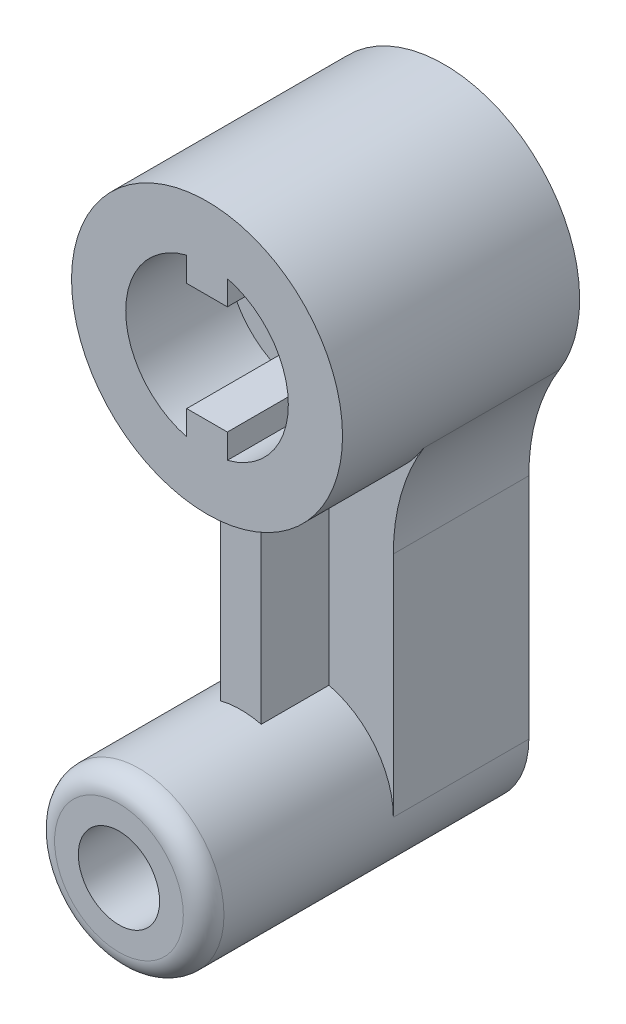
from build123d import *

# Parameters (mm, degrees)
SALIENTE_EXTRUIR1_DEPTH = 20
CROQUIS2_R              = 20
SALIENTE_EXTRUIR2_DEPTH = 35
CORTAR_EXTRUIR1_DEPTH   = 15
CORTAR_EXTRUIR2_REACH   = 68.332
CROQUIS4_R              = 4
CROQUIS5_R              = 12.5
CROQUIS5_R_2            = 6
SALIENTE_EXTRUIR3_DEPTH = 48
REDONDEO1_R             = 3
NERVIO1_REACH           = 91.22
CROQUIS6_WALL_W         = 207.940466532
CROQUIS6_WALL_H         = 6


with BuildPart() as part:
    # Croquis1 → Saliente-Extruir1 (new body)
    with BuildSketch(Plane.XY):
        with BuildLine():
            Line((-12.5, -26.339134382), (-12.5, -60))
            ThreePointArc((-12.5, -60), (0, -47.5), (12.5, -60))
            Line((12.5, -60), (12.5, -26.339134382))
            ThreePointArc((12.5, -26.339134382), (13.646923907, -18.12329602), (17, -10.535653753))
            ThreePointArc((17, -10.535653753), (0, -20), (-17, -10.535653753))
            ThreePointArc((-17, -10.535653753), (-13.646923907, -18.12329602), (-12.5, -26.339134382))
        make_face()
    extrude(amount=SALIENTE_EXTRUIR1_DEPTH)

    # Croquis2 → Saliente-Extruir2 (add)
    with BuildSketch(Plane.XY):
        with Locations(Location((0, 0, 0), (0, 0, 211.788330617))):
            Circle(CROQUIS2_R)
    extrude(amount=SALIENTE_EXTRUIR2_DEPTH)

    # Croquis3 → Cortar-Extruir1 (cut)
    with BuildSketch(Plane.XY.offset(35)):
        with BuildLine():
            Line((-3, 11.618950039), (-3, 8))
            Line((-3, 8), (3, 8))
            Line((3, 8), (3, 11.618950039))
            ThreePointArc((3, 11.618950039), (12, 0), (3, -11.618950039))
            Line((3, -11.618950039), (3, -8))
            Line((3, -8), (-3, -8))
            Line((-3, -8), (-3, -11.618950039))
            ThreePointArc((-3, -11.618950039), (-12, 0), (-3, 11.618950039))
        make_face()
    extrude(amount=-CORTAR_EXTRUIR1_DEPTH, mode=Mode.SUBTRACT)

    # Croquis4 → Cortar-Extruir2 (cut, up to next)
    with BuildSketch(Plane.XY.offset(20), mode=Mode.PRIVATE) as cortar_extruir2_sk1:
        Circle(CROQUIS4_R)
    cortar_extruir2_tool1 = extrude(cortar_extruir2_sk1.sketch, amount=-CORTAR_EXTRUIR2_REACH, mode=Mode.PRIVATE) & part.part
    add(cortar_extruir2_tool1.solids().sort_by_distance((0, 0, 20))[0], mode=Mode.SUBTRACT)

    # Croquis5 → Saliente-Extruir3 (add)
    with BuildSketch(Plane.XY):
        with Locations((0, -60)):
            Circle(CROQUIS5_R)
        with Locations((0, -60)):
            Circle(CROQUIS5_R_2, mode=Mode.SUBTRACT)
    extrude(amount=SALIENTE_EXTRUIR3_DEPTH)

    # Redondeo1
    redondeo1_edges = [part.edges().sort_by_distance(p)[0] for p in [
        (-12.5, -60, 48),
    ]]
    fillet(redondeo1_edges, radius=REDONDEO1_R)

    # Croquis6 wall → Nervio1 (add, up to next)
    with BuildSketch(Plane(origin=(0, -33.75, 30), x_dir=(0, -1, 0), z_dir=(0, 0, -1)), mode=Mode.PRIVATE) as nervio1_sk1:
        Rectangle(CROQUIS6_WALL_W, CROQUIS6_WALL_H)
    nervio1_tool1 = extrude(nervio1_sk1.sketch, amount=NERVIO1_REACH, mode=Mode.PRIVATE) - part.part
    add(nervio1_tool1.solids().sort_by_distance((0, -33.75, 30))[0])


solid = part.part
